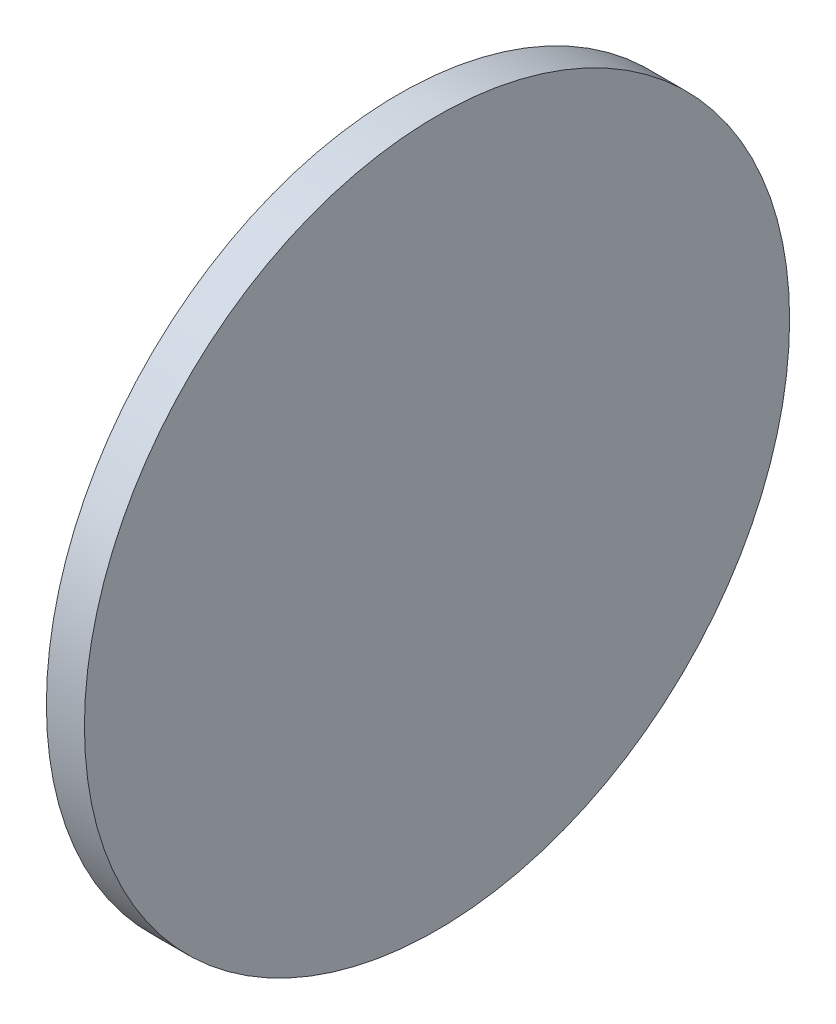
from build123d import *


with BuildPart() as part:
    # Sketch1 → Revolve1 (revolve)
    with BuildSketch(Plane.XY, mode=Mode.PRIVATE) as revolve1_sk:
        Polygon((0, 0), (0, 5), (0.5, 5), (0.5, 13.9), (2, 13.9), (2, 0), align=None)
    revolve(revolve1_sk.sketch.rotate(Axis((0, 0, 0), (1, 0, 0)), 90), axis=Axis((0, 0, 0), (1, 0, 0)))


solid = part.part
